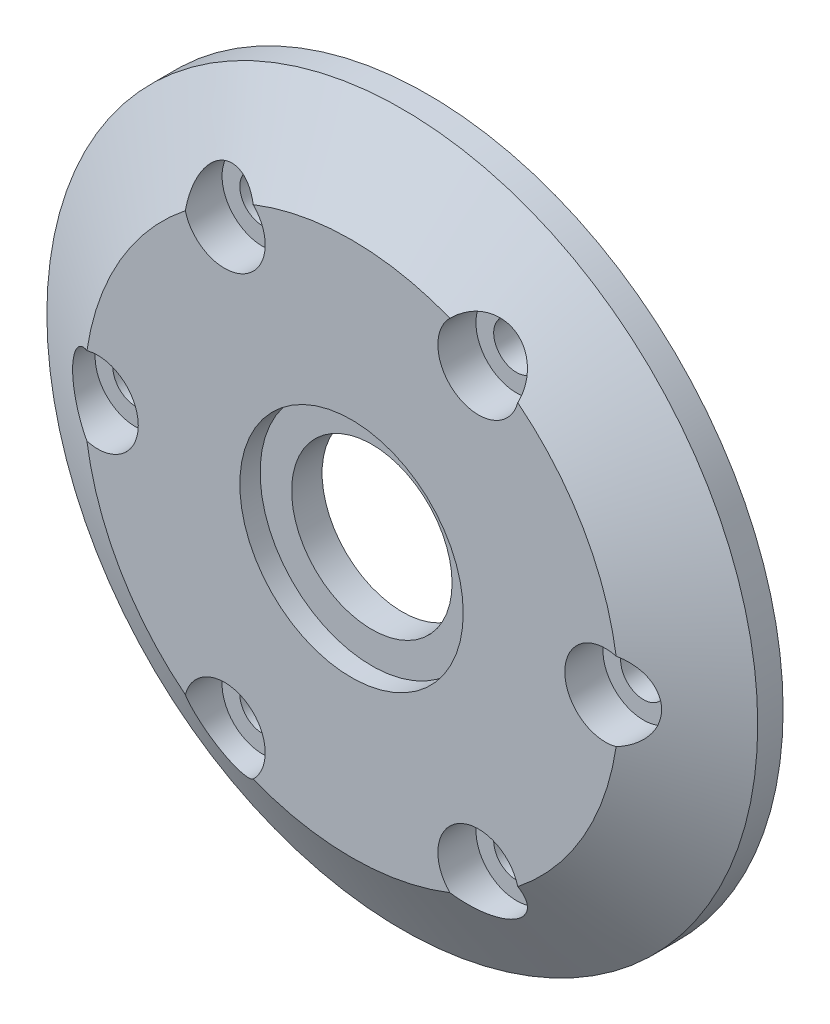
from build123d import *

# Parameters (mm, degrees)
SKETCH1_R               = 35
BOSS_EXTRUDE1_DEPTH     = 5
BOSS_EXTRUDE1_TAPER     = 60
SKETCH3_R               = 11
CUT_EXTRUDE1_DEPTH      = 2
SKETCH4_R               = 7.9
CUT_EXTRUDE2_DEPTH      = 81.661329025
SKETCH7_R               = 35
SKETCH7_R_2             = 12.95
BOSS_EXTRUDE2_DEPTH     = 2.5
CUT_EXTRUDE6_DEPTH      = 81.661329025
CUT_EXTRUDE6_DEPTH_BACK = 81.661329025
SKETCH5_R               = 2.25
SKETCH8_R               = 4
CUT_EXTRUDE8_DEPTH      = 3.75


with BuildPart() as part:
    # Sketch1 → Boss-Extrude1 (new body)
    with BuildSketch(Plane.XY):
        with Locations((0, 37.5)):
            Circle(SKETCH1_R)
    extrude(amount=BOSS_EXTRUDE1_DEPTH, taper=BOSS_EXTRUDE1_TAPER)

    # Sketch3 → Cut-Extrude1 (cut)
    with BuildSketch(Plane.XY.offset(5)):
        with Locations((0, 37.5)):
            Circle(SKETCH3_R)
    extrude(amount=-CUT_EXTRUDE1_DEPTH, mode=Mode.SUBTRACT)

    # Sketch4 → Cut-Extrude2 (cut, through all)
    with BuildSketch(Plane.XY.offset(5)):
        with Locations((0, 37.5)):
            Circle(SKETCH4_R)
    extrude(amount=-CUT_EXTRUDE2_DEPTH, mode=Mode.SUBTRACT)

    # Sketch7 → Boss-Extrude2 (add)
    with BuildSketch(Plane.XY):
        with Locations((0, 37.5)):
            Circle(SKETCH7_R)
        with Locations((0, 37.5)):
            Circle(SKETCH7_R_2, mode=Mode.SUBTRACT)
    extrude(amount=-BOSS_EXTRUDE2_DEPTH)

    # Sketch5 → Cut-Extrude6 (cut, two sides: drawn at the far end of the back side and taken through both)
    with BuildSketch(Plane.XY.offset(-CUT_EXTRUDE6_DEPTH_BACK)):
        with Locations(Location((-12.5, 15.849364905, 0), (0, 0, 184.499391781))):
            Circle(SKETCH5_R)
        with Locations(Location((-25, 37.5, 0), (0, 0, 124.499391764))):
            Circle(SKETCH5_R)
        with Locations(Location((-12.5, 59.150635095, 0), (0, 0, 175.50060828))):
            Circle(SKETCH5_R)
        with Locations(Location((12.5, 59.150635095, 0), (0, 0, 115.50060828))):
            Circle(SKETCH5_R)
        with Locations((25, 37.5)):
            Circle(SKETCH5_R)
        with Locations(Location((12.5, 15.849364905, 0), (0, 0, 244.499391764))):
            Circle(SKETCH5_R)
    extrude(amount=CUT_EXTRUDE6_DEPTH + CUT_EXTRUDE6_DEPTH_BACK, mode=Mode.SUBTRACT)

    # Sketch8 → Cut-Extrude8 (cut)
    with BuildSketch(Plane.XY.offset(5)):
        with Locations((-12.5, 59.150635095)):
            Circle(SKETCH8_R)
        with Locations((-25, 37.5)):
            Circle(SKETCH8_R)
        with Locations((12.5, 59.150635095)):
            Circle(SKETCH8_R)
        with Locations((25, 37.5)):
            Circle(SKETCH8_R)
        with Locations((12.5, 15.849364905)):
            Circle(SKETCH8_R)
        with Locations((-12.5, 15.849364905)):
            Circle(SKETCH8_R)
    extrude(amount=-CUT_EXTRUDE8_DEPTH, mode=Mode.SUBTRACT)


solid = part.part
